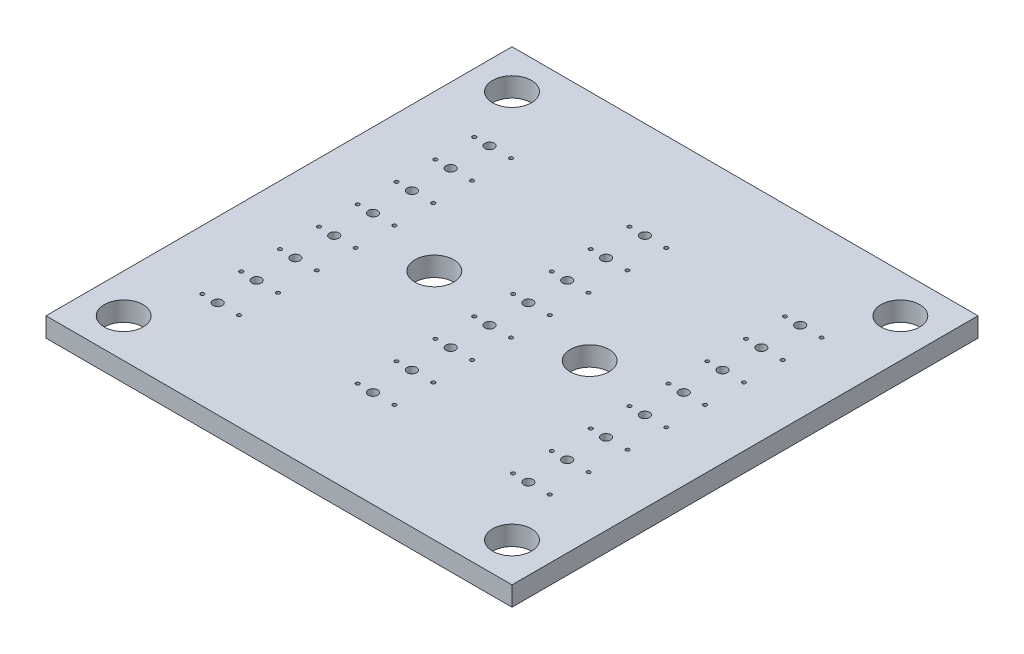
from build123d import *

# Parameters (mm, degrees)
BASEWITH_ALIGNMENT_W = 76.2
BASEWITH_ALIGNMENT_H = 76.2
BASEWITH_ALIGNMENT_R = 3.175
BOSS_EXTRUDE1_DEPTH  = 3.175
SKETCH1_R            = 0.762
SKETCH1_R_2          = 0.3
CUT_EXTRUDE6_DEPTH   = 88.643803261
LPATTERN1_COUNT      = 8
LPATTERN1_PITCH      = 6.35
LPATTERN1_COUNT_DIR2 = 3
LPATTERN1_PITCH_DIR2 = 25.4


with BuildPart() as part:
    # BaseWith Alignment → Boss-Extrude1 (new body)
    with BuildSketch(Plane(origin=(0, 0, 0), x_dir=(1, 0, 0), z_dir=(0, 1, 0))):
        with Locations((25.4, -22.225)):
            Rectangle(BASEWITH_ALIGNMENT_W, BASEWITH_ALIGNMENT_H)
        with Locations(Location((-6.35, 9.525, 0), (0, 0, 270))):
            Circle(BASEWITH_ALIGNMENT_R, mode=Mode.SUBTRACT)
        with Locations(Location((57.15, 9.525, 0), (0, 0, 270))):
            Circle(BASEWITH_ALIGNMENT_R, mode=Mode.SUBTRACT)
        with Locations(Location((-6.35, -53.975, 0), (0, 0, 270))):
            Circle(BASEWITH_ALIGNMENT_R, mode=Mode.SUBTRACT)
        with Locations(Location((57.15, -53.975, 0), (0, 0, 270))):
            Circle(BASEWITH_ALIGNMENT_R, mode=Mode.SUBTRACT)
        with Locations(Location((12.7, -22.225, 0), (0, 0, 270))):
            Circle(BASEWITH_ALIGNMENT_R, mode=Mode.SUBTRACT)
        with Locations(Location((38.1, -22.225, 0), (0, 0, 270))):
            Circle(BASEWITH_ALIGNMENT_R, mode=Mode.SUBTRACT)
    extrude(amount=BOSS_EXTRUDE1_DEPTH)

    # Sketch1 → Cut-Extrude6 (cut, through all)
    with BuildSketch(Plane(origin=(0, 0, 0), x_dir=(-1, 0, 0), z_dir=(0, -1, 0))):
        with Locations(Location((0.5, 0, 0), (0, 0, 90))):
            Circle(SKETCH1_R)
        with Locations(Location((3, 0, 0), (0, 0, 90))):
            Circle(SKETCH1_R_2)
        with Locations(Location((-3, 0, 0), (0, 0, 90))):
            Circle(SKETCH1_R_2)
    cut_extrude6 = extrude(amount=-CUT_EXTRUDE6_DEPTH, mode=Mode.SUBTRACT)

    # LPattern1: Cut-Extrude6 8 × 3
    with Locations(*[(j * LPATTERN1_PITCH_DIR2, 0, i * LPATTERN1_PITCH) for i in range(LPATTERN1_COUNT) for j in range(LPATTERN1_COUNT_DIR2) if (i, j) != (0, 0)]):
        add(cut_extrude6, mode=Mode.SUBTRACT)


solid = part.part
